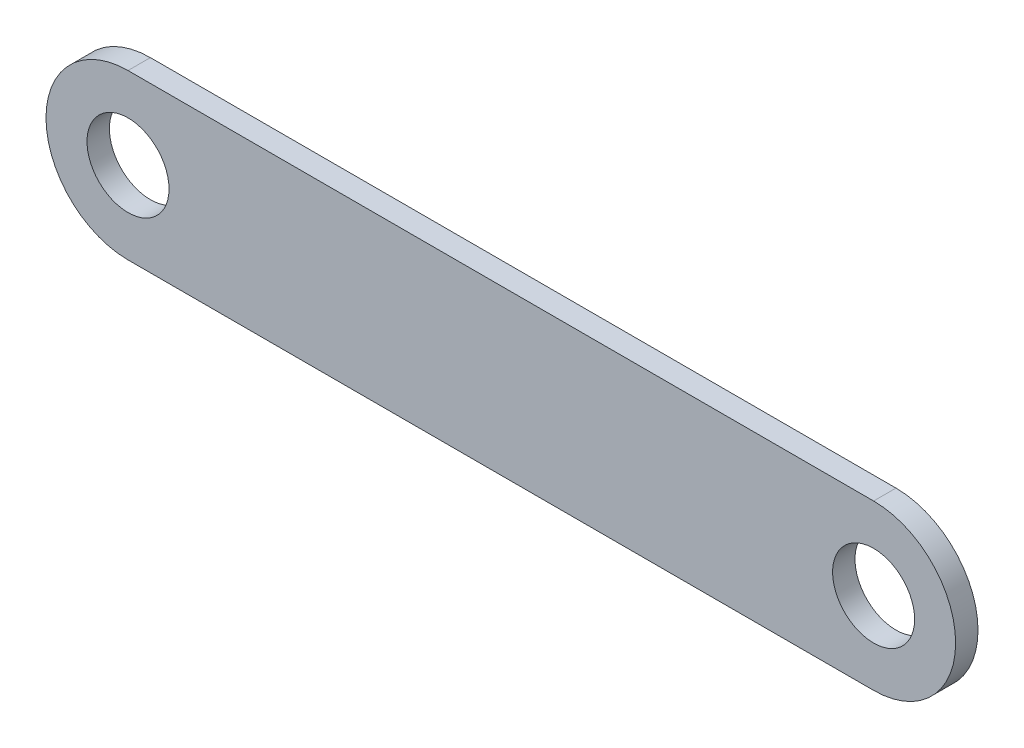
from build123d import *

# Parameters (mm, degrees)
SKETCH1_R           = 11
BOSS_EXTRUDE3_DEPTH = 6


with BuildPart() as part:
    # Sketch1 → Boss-Extrude3 (new body)
    with BuildSketch(Plane.XY):
        with BuildLine():
            Line((-100, 22), (100, 22))
            ThreePointArc((100, 22), (122, 0), (100, -22))
            Line((100, -22), (-100, -22))
            ThreePointArc((-100, -22), (-122, 0), (-100, 22))
        make_face()
        with Locations((100, 0)):
            Circle(SKETCH1_R, mode=Mode.SUBTRACT)
        with Locations((-100, 0)):
            Circle(SKETCH1_R, mode=Mode.SUBTRACT)
    extrude(amount=BOSS_EXTRUDE3_DEPTH)


solid = part.part
